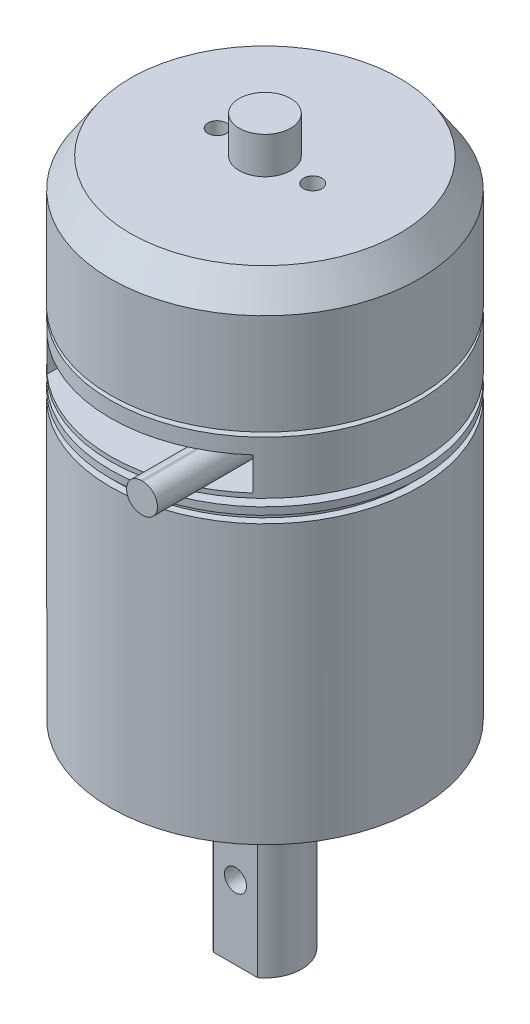
from build123d import *

# Parameters (mm, degrees)
SKETCH_2_W               = 28
SKETCH_2_H               = 4.5
CUT_EXTRUDE_1_DEPTH      = 10
EXTRUDE_1_DEPTH          = 15
HOLE_WIZARD_M3_1_D       = 2.5
HOLE_WIZARD_M3_1_DEPTH   = 4
HOLE_WIZARD_M3_1_TIP     = 0.751075774
CUT_EXTRUDE_START        = -20
CUT_EXTRUDE_2_DEPTH      = 20
HOLE_WIZARD_M4_1_D       = 3.3
HOLE_WIZARD_M4_1_DEPTH   = 10.1
HOLE_WIZARD_M4_1_TIP     = 0.991420021
CUT_EXTRUDE_3_DEPTH      = 64.617293246
CUT_EXTRUDE_3_DEPTH_BACK = 64.617293246
SKETCH_11_R              = 1.5


with BuildPart() as part:
    # 草图1 → 旋转1 (revolve)
    with BuildSketch(Plane.XY, mode=Mode.PRIVATE) as revolve_1_sk:
        Polygon((0, 0), (4.1, 0), (4.1, 6.7), (13.4, 6.7), (13.4, 8.7), (21, 8.7), (21, 10.2), (20, 10.2), (20, 11.2), (21, 11.2), (21, 12.2), (10, 12.2), (10, 13.2), (21, 13.2), (21, 20.4), (5, 20.4), (5, 21), (21, 21), (21, 34.7), (18.3, 38.7), (3.5, 38.7), (3.5, 43.7), (0, 43.7), align=None)
    revolve(revolve_1_sk.sketch.rotate(Axis((0, 43.7, 0), (0, -1, 0)), 90), axis=Axis((0, 43.7, 0), (0, -1, 0)))

    # 草图2 → 切除-拉伸1 (cut)
    with BuildSketch(Plane.XY.offset(21)):
        with Locations((0, 16.05)):
            Rectangle(SKETCH_2_W, SKETCH_2_H)
    extrude(amount=-CUT_EXTRUDE_1_DEPTH, mode=Mode.SUBTRACT)

    # 草图3 → 凸台-拉伸1 (add)
    with BuildSketch(Plane.XY.offset(11)):
        with BuildLine():
            Line((9.185056323, 18.053194417), (9.385056323, 18.053194417))
            ThreePointArc((9.385056323, 18.053194417), (11.385056323, 16.053194417), (9.385056323, 14.053194417))
            Line((9.385056323, 14.053194417), (9.185056323, 14.053194417))
            ThreePointArc((9.185056323, 14.053194417), (7.185056323, 16.053194417), (9.185056323, 18.053194417))
        make_face()
    extrude(amount=EXTRUDE_1_DEPTH)

    # M3 螺纹孔1
    with Locations(Plane(origin=(0, 38.7, 0), x_dir=(1, 0, 0), z_dir=(0, 1, 0))):
        with Locations((-6.5, 0), (6.5, 0)):
            Hole(HOLE_WIZARD_M3_1_D / 2, depth=HOLE_WIZARD_M3_1_DEPTH)
            with Locations((0, 0, -(HOLE_WIZARD_M3_1_DEPTH + HOLE_WIZARD_M3_1_TIP / 2))):  # 118° drill point
                Cone(0, HOLE_WIZARD_M3_1_D / 2, HOLE_WIZARD_M3_1_TIP, mode=Mode.SUBTRACT)

    # 草图7 → 旋转2 (revolve)
    with BuildSketch(Plane.XY, mode=Mode.PRIVATE) as revolve_2_sk:
        Polygon((0, -54.6), (5, -54.6), (5, -30.5), (8.275, -30.5), (8.275, -29.6), (13, -29.6), (13, -27.6), (21, -27.6), (21, 8.7), (0, 8.7), align=None)
    revolve(revolve_2_sk.sketch.rotate(Axis((0, 8.7, 0), (0, -1, 0)), 180), axis=Axis((0, 8.7, 0), (0, -1, 0)))

    # 草图8 → 切除-拉伸2 (cut)
    with BuildSketch(Plane.XZ.offset(54.6).offset(CUT_EXTRUDE_START)):
        with BuildLine():
            Line((-3, 4), (3, 4))
            ThreePointArc((3, 4), (0, 5), (-3, 4))
        make_face()
    extrude(amount=CUT_EXTRUDE_2_DEPTH, mode=Mode.SUBTRACT)

    # M4 螺纹孔1
    with Locations(Plane(origin=(0, -27.6, 0), x_dir=(-1, 0, 0), z_dir=(0, -1, 0))):
        with Locations((0, -17.5), (-17.5, 0), (0, 17.5), (17.5, 0)):
            Hole(HOLE_WIZARD_M4_1_D / 2, depth=HOLE_WIZARD_M4_1_DEPTH)
            with Locations((0, 0, -(HOLE_WIZARD_M4_1_DEPTH + HOLE_WIZARD_M4_1_TIP / 2))):  # 118° drill point
                Cone(0, HOLE_WIZARD_M4_1_D / 2, HOLE_WIZARD_M4_1_TIP, mode=Mode.SUBTRACT)

    # 草图11 → 切除-拉伸3 (cut, two sides: drawn at the far end of the back side and taken through both)
    with BuildSketch(Plane.XY.offset(4).offset(-CUT_EXTRUDE_3_DEPTH_BACK)):
        with Locations((0, -44.6)):
            Circle(SKETCH_11_R)
    extrude(amount=CUT_EXTRUDE_3_DEPTH + CUT_EXTRUDE_3_DEPTH_BACK, mode=Mode.SUBTRACT)


solid = part.part
